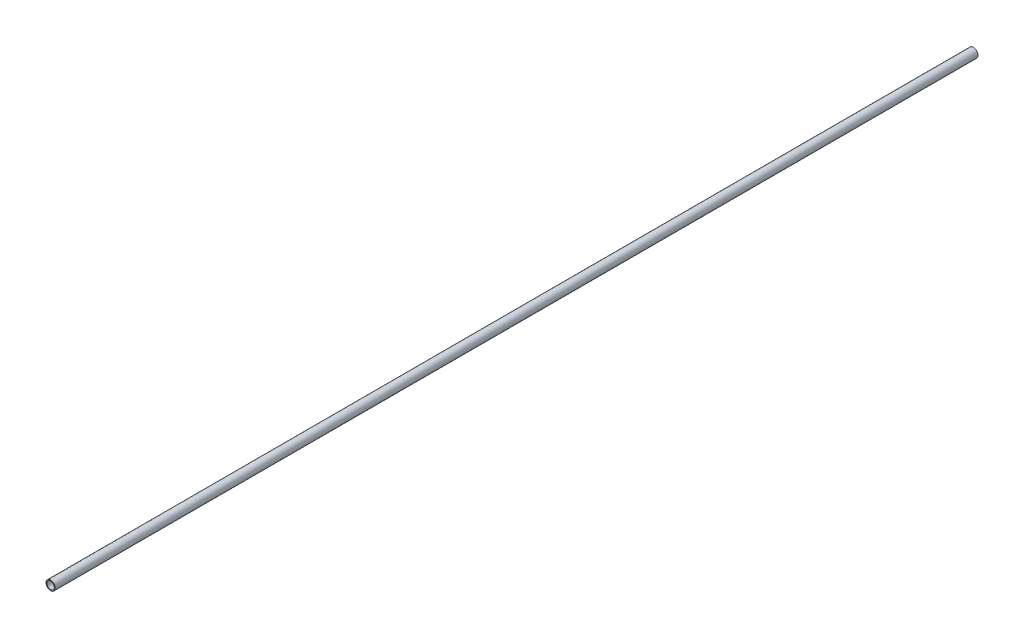
from build123d import *

# Parameters (mm, degrees)
SKETCH_1_R      = 5
SKETCH_1_R_2    = 4
EXTRUDE_1_DEPTH = 500


with BuildPart() as part:
    # Эскиз1 → Бобышка-Вытянуть1 (new, symmetric)
    with BuildSketch(Plane.XY):
        Circle(SKETCH_1_R)
        Circle(SKETCH_1_R_2, mode=Mode.SUBTRACT)
    extrude(amount=EXTRUDE_1_DEPTH, both=True)


solid = part.part
